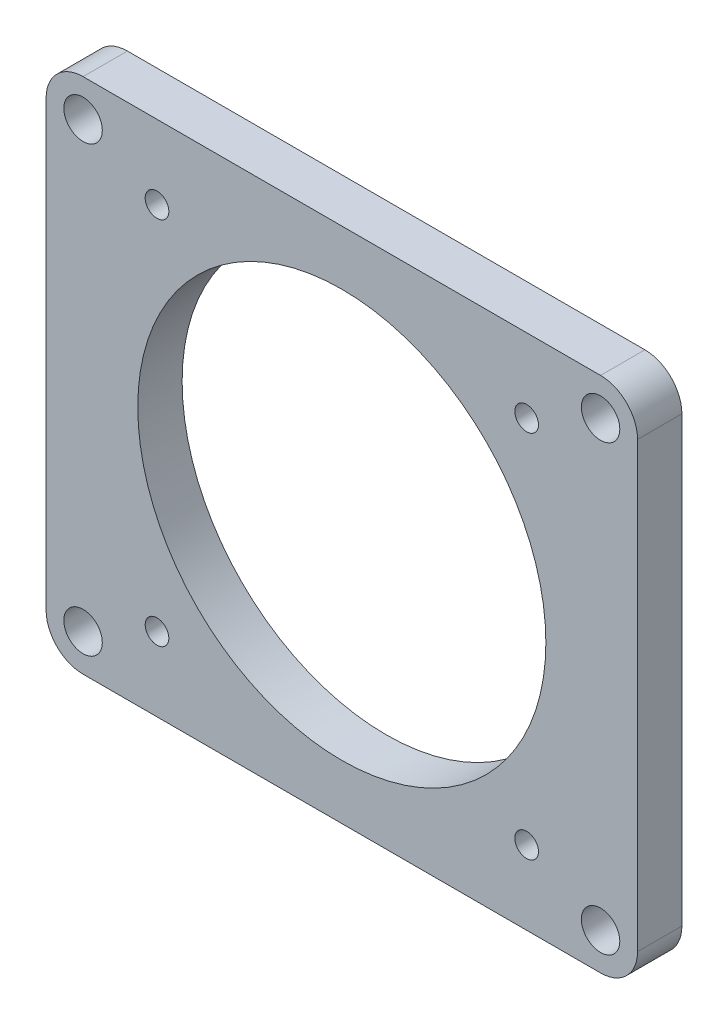
from build123d import *

# Parameters (mm, degrees)
SKETCH1_R           = 27.6
SKETCH1_R_2         = 2.6
BOSS_EXTRUDE1_DEPTH = 6
SKETCH4_R           = 1.6
CUT_EXTRUDE2_DEPTH  = 54.488316481
CUT_EXTRUDE3_DEPTH  = 2.5


with BuildPart() as part:
    # Sketch1 → Boss-Extrude1 (new body)
    with BuildSketch(Plane.XY):
        with BuildLine():
            Line((-35, 35), (35, 35))
            ThreePointArc((35, 35), (38.535533906, 33.535533906), (40, 30))
            Line((40, 30), (40, -30))
            ThreePointArc((40, -30), (38.535533906, -33.535533906), (35, -35))
            Line((35, -35), (-35, -35))
            ThreePointArc((-35, -35), (-38.535533906, -33.535533906), (-40, -30))
            Line((-40, -30), (-40, 30))
            ThreePointArc((-40, 30), (-38.535533906, 33.535533906), (-35, 35))
        make_face()
        Circle(SKETCH1_R, mode=Mode.SUBTRACT)
        with Locations((-35, 30)):
            Circle(SKETCH1_R_2, mode=Mode.SUBTRACT)
        with Locations((-35, -30)):
            Circle(SKETCH1_R_2, mode=Mode.SUBTRACT)
        with Locations((35, -30)):
            Circle(SKETCH1_R_2, mode=Mode.SUBTRACT)
        with Locations((35, 30)):
            Circle(SKETCH1_R_2, mode=Mode.SUBTRACT)
    extrude(amount=BOSS_EXTRUDE1_DEPTH)

    # Sketch4 → Cut-Extrude2 (cut, through all)
    with BuildSketch(Plane(origin=(0, 0, 0), x_dir=(-1, 0, 0), z_dir=(0, 0, -1))):
        with Locations((-25, 25)):
            Circle(SKETCH4_R)
        with Locations((25, 25)):
            Circle(SKETCH4_R)
        with Locations((-25, -25)):
            Circle(SKETCH4_R)
        with Locations((25, -25)):
            Circle(SKETCH4_R)
    extrude(amount=-CUT_EXTRUDE2_DEPTH, mode=Mode.SUBTRACT)

    # Sketch5 → Cut-Extrude3 (cut)
    with BuildSketch(Plane(origin=(0, 0, 0), x_dir=(-1, 0, 0), z_dir=(0, 0, -1))):
        Polygon((-28.290896534, 25), (-26.645448267, 22.15), (-23.354551733, 22.15), (-21.709103466, 25), (-23.354551733, 27.85), (-26.645448267, 27.85), align=None)
        Polygon((21.709103466, 25), (23.354551733, 22.15), (26.645448267, 22.15), (28.290896534, 25), (26.645448267, 27.85), (23.354551733, 27.85), align=None)
        Polygon((-28.29088256, -24.990409574), (-26.653746833, -27.845192685), (-23.362864273, -27.854783111), (-21.70911744, -25.009590426), (-23.346253167, -22.154807315), (-26.637135727, -22.145216889), align=None)
        Polygon((28.290801988, -24.975054549), (26.6237976, -22.137609154), (23.332995612, -22.162554605), (21.709198012, -25.024945451), (23.3762024, -27.862390846), (26.667004388, -27.837445395), align=None)
    extrude(amount=-CUT_EXTRUDE3_DEPTH, mode=Mode.SUBTRACT)


solid = part.part
